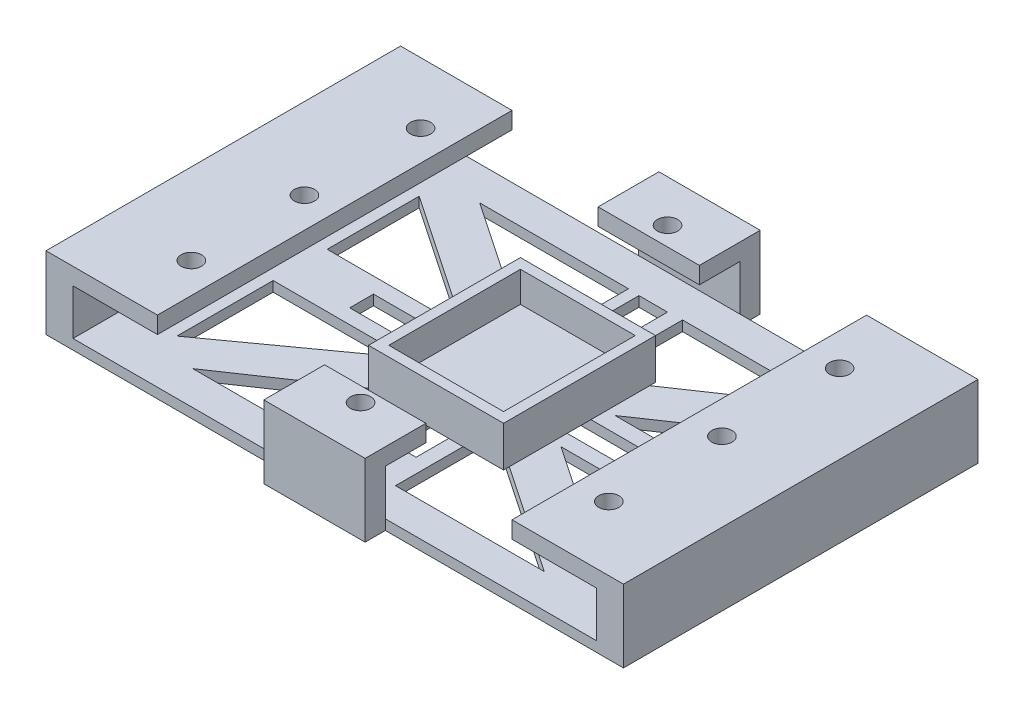
from build123d import *

# Parameters (mm, degrees)
SKETCH1_W                = 155
SKETCH1_H                = 105
SKETCH1_W_2              = 125.476190476
SKETCH1_H_2              = 85
BOSS_EXTRUDE1_DEPTH      = 3
BOSS_EXTRUDE2_DEPTH      = 18.5
BOSS_EXTRUDE2_DEPTH_BACK = 3
SKETCH2_W                = 8
SKETCH2_H                = 105
BOSS_EXTRUDE3_DEPTH      = 18.5
BOSS_EXTRUDE3_DEPTH_BACK = 3
SKETCH3_W                = 30
SKETCH3_H                = 6
SKETCH4_W                = 25
SKETCH4_H                = 105
SKETCH4_W_2              = 30
SKETCH4_H_2              = 12
BOSS_EXTRUDE4_DEPTH      = 5
SKETCH5_R                = 12
SKETCH5_W                = 8.45267088
SKETCH5_H                = 74.460442491
SKETCH5_W_2              = 90.792338418
SKETCH5_H_2              = 7.04119429
CUT_EXTRUDE1_DEPTH       = 5
SKETCH7_R                = 3
CUT_EXTRUDE3_DEPTH       = 5
SKETCH8_W                = 40
SKETCH8_H                = 45
BOSS_EXTRUDE7_DEPTH      = 12
SKETCH10_W               = 34
SKETCH10_H               = 39
CUT_EXTRUDE4_DEPTH       = 9


with BuildPart() as part:
    # Sketch1 → Boss-Extrude1 (new body)
    # profile 1 of 2: a face of its own
    with BuildSketch(Plane(origin=(0, 0, 0), x_dir=(1, 0, 0), z_dir=(0, 1, 0))):
        Rectangle(SKETCH1_W, SKETCH1_H)
        Rectangle(SKETCH1_W_2, SKETCH1_H_2, mode=Mode.SUBTRACT)
    # profile 2 of 2: a face of its own
    with BuildSketch(Plane(origin=(0, 0, 0), x_dir=(1, 0, 0), z_dir=(0, 1, 0))):
        Polygon((62.738095238, 8), (22.507606796, 8), (36.015047402, 17.1502017), (62.738095238, 35.252911525), (62.738095238, 42.5), (52.040012251, 42.5), (29.28486966, 27.085225986), (8, 12.666443314), (8, 42.5), (-8, 42.5), (-8, 12.666443314), (-22.464140061, 22.464731742), (-52.040012251, 42.5), (-62.738095238, 42.5), (-62.738095238, 35.252911525), (-29.194317803, 12.529707456), (-22.507606796, 8), (-62.738095238, 8), (-62.738095238, -8), (-23.178437825, -8), (-62.738095238, -36.5), (-62.738095238, -42.5), (-52.040012251, -42.5), (-21.061503369, -21.514558499), (-8, -12.666443314), (-8, -42.5), (8, -42.5), (8, -12.666443314), (21.061503369, -21.514558499), (52.040012251, -42.5), (62.738095238, -42.5), (62.738095238, -35.252911525), (27.791681111, -11.579534213), (22.507606796, -8), (62.738095238, -8), align=None)
    extrude(amount=BOSS_EXTRUDE1_DEPTH)

    # Sketch2 → Boss-Extrude2 (add, two sides: drawn at the far end of the back side and taken through both)
    with BuildSketch(Plane(origin=(0, 3, 0), x_dir=(1, 0, 0), z_dir=(0, 1, 0)).offset(-BOSS_EXTRUDE2_DEPTH_BACK)):
        with Locations((-81.5, 0)):
            Rectangle(SKETCH2_W, SKETCH2_H)
        with Locations((81.5, 0)):
            Rectangle(SKETCH2_W, SKETCH2_H)
    extrude(amount=BOSS_EXTRUDE2_DEPTH + BOSS_EXTRUDE2_DEPTH_BACK)

    # Sketch3 → Boss-Extrude3 (add, two sides: drawn at the far end of the back side and taken through both)
    with BuildSketch(Plane(origin=(0, 3, 0), x_dir=(1, 0, 0), z_dir=(0, 1, 0)).offset(-BOSS_EXTRUDE3_DEPTH_BACK)):
        with Locations((0, -55.5)):
            Rectangle(SKETCH3_W, SKETCH3_H)
        with Locations((0, 55.5)):
            Rectangle(SKETCH3_W, SKETCH3_H)
    extrude(amount=BOSS_EXTRUDE3_DEPTH + BOSS_EXTRUDE3_DEPTH_BACK)

    # Sketch4 → Boss-Extrude4 (add)
    with BuildSketch(Plane(origin=(0, 21.5, 0), x_dir=(1, 0, 0), z_dir=(0, 1, 0))):
        with Locations((-65, 0)):
            Rectangle(SKETCH4_W, SKETCH4_H)
        with Locations((65, 0)):
            Rectangle(SKETCH4_W, SKETCH4_H)
        with Locations((0, 46.5)):
            Rectangle(SKETCH4_W_2, SKETCH4_H_2)
        with Locations((0, -46.5)):
            Rectangle(SKETCH4_W_2, SKETCH4_H_2)
    extrude(amount=-BOSS_EXTRUDE4_DEPTH)

    # Sketch5 → Cut-Extrude1 (cut)
    with BuildSketch(Plane(origin=(0, 3, 0), x_dir=(1, 0, 0), z_dir=(0, 1, 0))):
        Circle(SKETCH5_R)
        with Locations((-0.467592264, 5.065542336)):
            Rectangle(SKETCH5_W, SKETCH5_H)
        with Locations((1.005079981, -0.147085174)):
            Rectangle(SKETCH5_W_2, SKETCH5_H_2)
    extrude(amount=-CUT_EXTRUDE1_DEPTH, mode=Mode.SUBTRACT)

    # Sketch7 → Cut-Extrude3 (cut)
    with BuildSketch(Plane(origin=(0, 21.5, 0), x_dir=(1, 0, 0), z_dir=(0, 1, 0))):
        with Locations(Location((-61.471836621, 0, 0), (0, 0, 270))):
            Circle(SKETCH7_R)
        with Locations(Location((62.160596695, 0, 0), (0, 0, 270))):
            Circle(SKETCH7_R)
        with Locations(Location((-61.471836621, 34.395123429, 0), (0, 0, 270))):
            Circle(SKETCH7_R)
        with Locations(Location((-61.471836621, -33.490958607, 0), (0, 0, 270))):
            Circle(SKETCH7_R)
        with Locations(Location((62.160596695, 34.861702835, 0), (0, 0, 270))):
            Circle(SKETCH7_R)
        with Locations(Location((62.160596695, -33.490958607, 0), (0, 0, 270))):
            Circle(SKETCH7_R)
        with Locations(Location((0, -44.855499831, 0), (0, 0, 270))):
            Circle(SKETCH7_R)
        with Locations(Location((0, 46.060829961, 0), (0, 0, 270))):
            Circle(SKETCH7_R)
    extrude(amount=-CUT_EXTRUDE3_DEPTH, mode=Mode.SUBTRACT)

    # Sketch8 → Boss-Extrude7 (add)
    with BuildSketch(Plane(origin=(0, 3, 0), x_dir=(1, 0, 0), z_dir=(0, 1, 0))):
        Rectangle(SKETCH8_W, SKETCH8_H)
    extrude(amount=BOSS_EXTRUDE7_DEPTH)

    # Sketch10 → Cut-Extrude4 (cut)
    with BuildSketch(Plane(origin=(0, 15, 0), x_dir=(1, 0, 0), z_dir=(0, 1, 0))):
        Rectangle(SKETCH10_W, SKETCH10_H)
    extrude(amount=-CUT_EXTRUDE4_DEPTH, mode=Mode.SUBTRACT)


solid = part.part
